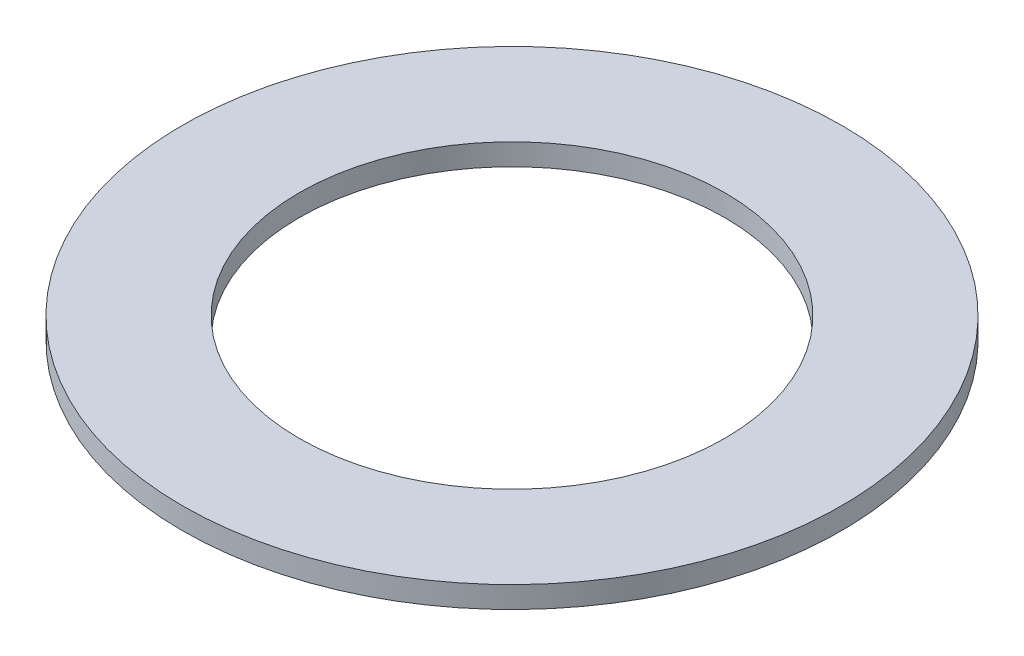
from build123d import *

# Parameters (mm, degrees)
SKETCH1_R           = 76.2
SKETCH1_R_2         = 49.2
BOSS_EXTRUDE1_DEPTH = 5


with BuildPart() as part:
    # Sketch1 → Boss-Extrude1 (new body)
    with BuildSketch(Plane(origin=(0, 0, 0), x_dir=(1, 0, 0), z_dir=(0, 1, 0))):
        with Locations(Location((0, 0, 0), (0, 0, 270))):
            Circle(SKETCH1_R)
        with Locations(Location((0, 0, 0), (0, 0, 270))):
            Circle(SKETCH1_R_2, mode=Mode.SUBTRACT)
    extrude(amount=BOSS_EXTRUDE1_DEPTH)


solid = part.part
